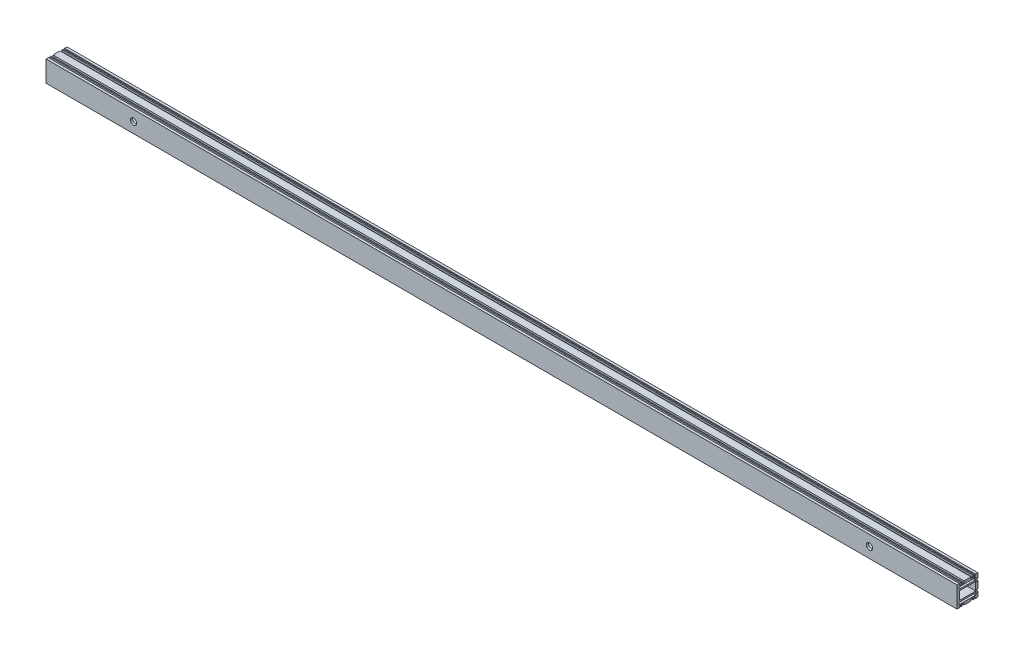
from build123d import *

# Parameters (mm, degrees)
SKETCH_1_W             = 23.5
SKETCH_1_H             = 12
EXTRUDE_1_DEPTH        = 650.5
HOLE_WIZARD_M6_1_D     = 5
HOLE_WIZARD_M6_1_DEPTH = 19
HOLE_WIZARD_M6_1_TIP   = 1.502151548
HOLE_WIZARD_M6_2_D     = 5
HOLE_WIZARD_M6_2_DEPTH = 19
HOLE_WIZARD_M6_2_TIP   = 1.502151548
HOLE_WIZARD_M4_1_D     = 3.3
HOLE_WIZARD_M4_1_DEPTH = 15.5
HOLE_WIZARD_M4_1_TIP   = 0.991420021
HOLE_WIZARD_9_0_9_1_D  = 9
HOLE_WIZARD_M4_2_D     = 3.3
HOLE_WIZARD_M4_2_DEPTH = 15.5
HOLE_WIZARD_M4_2_TIP   = 0.991420021


with BuildPart() as part:
    # 草图1 → 凸台-拉伸1 (new, symmetric)
    with BuildSketch(Plane(origin=(0, 0, 0), x_dir=(0, 0, -1), z_dir=(1, 0, 0))):
        Polygon((-15, 15), (-11.5, 15), (-11.5, 13.5), (-11, 13.5), (-11, 12), (-9.5, 12), (-9.5, 15), (-8, 15), (-8, 12.5), (-5, 12.5), (-5, 15), (5, 15), (5, 12.5), (8, 12.5), (8, 15), (9.5, 15), (9.5, 12), (11, 12), (11, 13.5), (11.5, 13.5), (11.5, 15), (15, 15), (15, 8), (12.5, 8), (12.5, 5), (15, 5), (15, -5), (12.5, -5), (12.5, -8), (15, -8), (15, -15), (11.5, -15), (11.5, -13.5), (11, -13.5), (11, -12), (9.5, -12), (9.5, -15), (8, -15), (8, -12.5), (5, -12.5), (5, -15), (-5, -15), (-5, -12.5), (-8, -12.5), (-8, -15), (-9.5, -15), (-9.5, -12), (-11, -12), (-11, -13.5), (-11.5, -13.5), (-11.5, -15), (-15, -15), align=None)
        with BuildLine():
            Line((12, -10.5), (12, -8.5))
            ThreePointArc((12, -8.5), (11.853553391, -8.146446609), (11.5, -8))
            Line((11.5, -8), (-11.5, -8))
            ThreePointArc((-11.5, -8), (-11.853553391, -8.146446609), (-12, -8.5))
            Line((-12, -8.5), (-12, -10.5))
            ThreePointArc((-12, -10.5), (-11.853553391, -10.853553391), (-11.5, -11))
            Line((-11.5, -11), (11.5, -11))
            ThreePointArc((11.5, -11), (11.853553391, -10.853553391), (12, -10.5))
        make_face(mode=Mode.SUBTRACT)
        with BuildLine():
            Line((-11.5, 11), (11.5, 11))
            ThreePointArc((11.5, 11), (11.853553391, 10.853553391), (12, 10.5))
            Line((12, 10.5), (12, 8.5))
            ThreePointArc((12, 8.5), (11.853553391, 8.146446609), (11.5, 8))
            Line((11.5, 8), (-11.5, 8))
            ThreePointArc((-11.5, 8), (-11.853553391, 8.146446609), (-12, 8.5))
            Line((-12, 8.5), (-12, 10.5))
            ThreePointArc((-12, 10.5), (-11.853553391, 10.853553391), (-11.5, 11))
        make_face(mode=Mode.SUBTRACT)
        Rectangle(SKETCH_1_W, SKETCH_1_H, mode=Mode.SUBTRACT)
    extrude(amount=EXTRUDE_1_DEPTH, both=True)

    # M6 螺纹孔1
    with Locations(Plane(origin=(0, -15, 0), x_dir=(-1, 0, 0), z_dir=(0, -1, 0))):
        with Locations((630.5, 0), (615.5, 0), (-615.5, 0), (-630.5, 0)):
            Hole(HOLE_WIZARD_M6_1_D / 2, depth=HOLE_WIZARD_M6_1_DEPTH)
            with Locations((0, 0, -(HOLE_WIZARD_M6_1_DEPTH + HOLE_WIZARD_M6_1_TIP / 2))):  # 118° drill point
                Cone(0, HOLE_WIZARD_M6_1_D / 2, HOLE_WIZARD_M6_1_TIP, mode=Mode.SUBTRACT)

    # M6 螺纹孔2
    with Locations(Plane(origin=(0, 0, -15), x_dir=(-1, 0, 0), z_dir=(0, 0, -1))):
        with Locations((-630.5, 0), (-615.5, 0), (630.5, 0), (615.5, 0)):
            Hole(HOLE_WIZARD_M6_2_D / 2, depth=HOLE_WIZARD_M6_2_DEPTH)
            with Locations((0, 0, -(HOLE_WIZARD_M6_2_DEPTH + HOLE_WIZARD_M6_2_TIP / 2))):  # 118° drill point
                Cone(0, HOLE_WIZARD_M6_2_D / 2, HOLE_WIZARD_M6_2_TIP, mode=Mode.SUBTRACT)

    # M4 螺纹孔1
    with Locations(Plane(origin=(0, -15, 0), x_dir=(-1, 0, 0), z_dir=(0, -1, 0))):
        with Locations((560, 0), (280, 0), (0, 0), (-280, 0), (-560, 0)):
            Hole(HOLE_WIZARD_M4_1_D / 2, depth=HOLE_WIZARD_M4_1_DEPTH)
            with Locations((0, 0, -(HOLE_WIZARD_M4_1_DEPTH + HOLE_WIZARD_M4_1_TIP / 2))):  # 118° drill point
                Cone(0, HOLE_WIZARD_M4_1_D / 2, HOLE_WIZARD_M4_1_TIP, mode=Mode.SUBTRACT)

    # Ø9.0 (9) 直径孔1 (through all)
    with Locations(Plane.XY.offset(15)):
        with Locations((525.5, 0), (-525.5, 0)):
            Hole(HOLE_WIZARD_9_0_9_1_D / 2)

    # M4 螺纹孔2
    with Locations(Plane(origin=(0, 0, -15), x_dir=(-1, 0, 0), z_dir=(0, 0, -1))):
        with Locations((-460, 0), (-230, 0), (0, 0), (230, 0), (460, 0), (-511.5, 0), (-539.5, 0), (539.5, 0), (511.5, 0)):
            Hole(HOLE_WIZARD_M4_2_D / 2, depth=HOLE_WIZARD_M4_2_DEPTH)
            with Locations((0, 0, -(HOLE_WIZARD_M4_2_DEPTH + HOLE_WIZARD_M4_2_TIP / 2))):  # 118° drill point
                Cone(0, HOLE_WIZARD_M4_2_D / 2, HOLE_WIZARD_M4_2_TIP, mode=Mode.SUBTRACT)


solid = part.part
